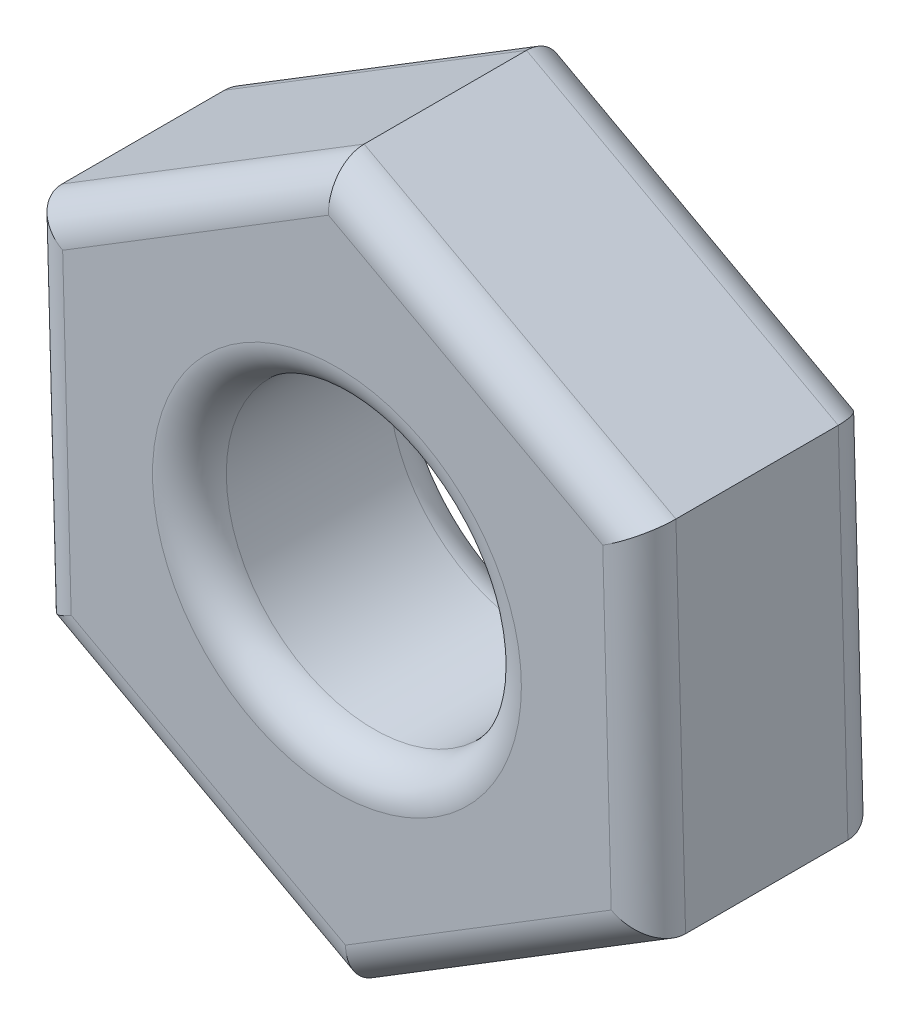
from build123d import *

# Parameters (mm, degrees)
SKETCH1_R           = 1
BOSS_EXTRUDE1_DEPTH = 1.6
FILLET1_R           = 0.25


with BuildPart() as part:
    # Sketch1 → Boss-Extrude1 (new body)
    with BuildSketch(Plane.XY):
        Polygon((-2.047224809, -1.257656856), (0.065550382, -2.40177712), (2.112775191, -1.144120264), (2.047224809, 1.257656856), (-0.065550382, 2.40177712), (-2.112775191, 1.144120264), align=None)
        Circle(SKETCH1_R, mode=Mode.SUBTRACT)
    extrude(amount=BOSS_EXTRUDE1_DEPTH)

    # Fillet1
    fillet1_edges = [part.edges().sort_by_distance(p)[0] for p in [
        (1.089162786, -1.772948692, 1.6),
        (2.08, 0.056768296, 1.6),
        (-1, 0, 0),
        (-1, 0, 1.6),
        (0.990837214, 1.829716988, 1.6),
        (-1.089162786, 1.772948692, 1.6),
        (-2.08, -0.056768296, 1.6),
        (-1.089162786, 1.772948692, 0),
        (0.990837214, 1.829716988, 0),
        (2.08, 0.056768296, 0),
        (1.089162786, -1.772948692, 0),
        (-0.990837214, -1.829716988, 0),
        (-2.08, -0.056768296, 0),
        (-0.990837214, -1.829716988, 1.6),
    ]]
    fillet(fillet1_edges, radius=FILLET1_R)


solid = part.part
